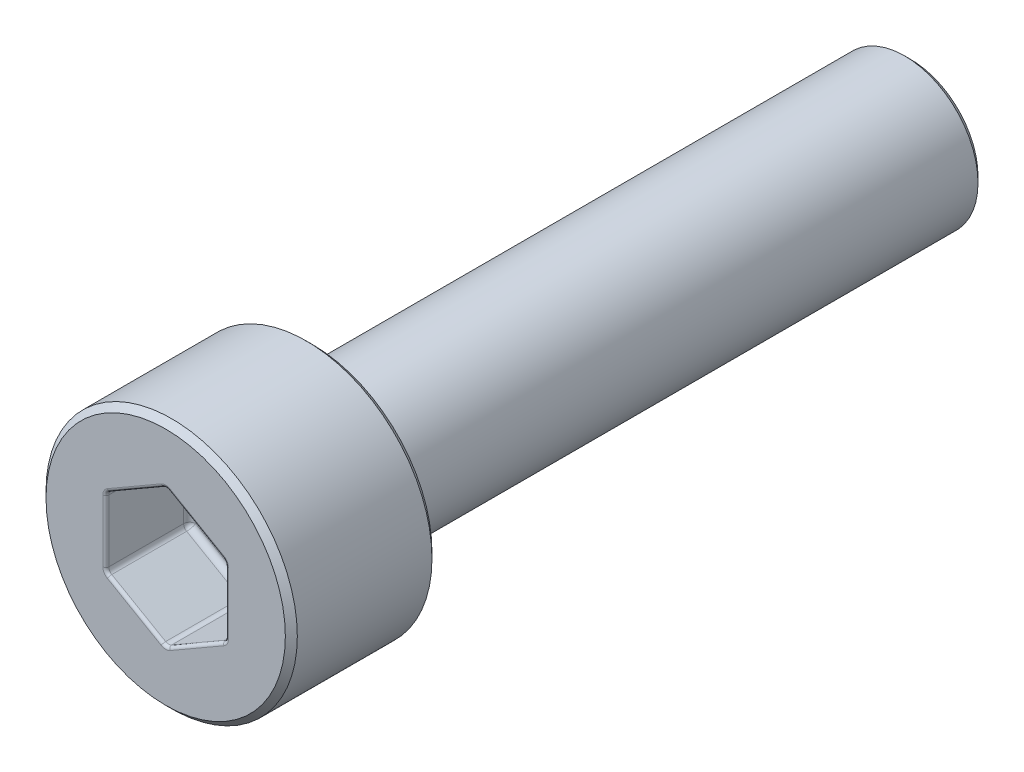
from build123d import *

# Parameters (mm, degrees)
SCHNITT_LINEAR_AUSTRAGEN1_DEPTH = 2.8
FASE1_SIZE                      = 0.2
VERRUNDUNG1_R                   = 0.2
VERRUNDUNG2_R                   = 0.1


with BuildPart() as part:
    # Skizze1 → Rotation1 (revolve)
    with BuildSketch(Plane(origin=(0, 0, 0), x_dir=(0, 0, -1), z_dir=(1, 0, 0))):
        Polygon((-4.9, 0), (-4.9, 4.2), (0, 4.2), (0, 2.45), (20, 2.45), (20, 0), align=None)
    revolve(axis=Axis((0, 0, 21.919879518), (0, 0, -1)))

    # Skizze2 → Schnitt-Linear austragen1 (cut)
    with BuildSketch(Plane.XY.offset(4.9)):
        Polygon((2, -1.154700538), (2, 1.154700538), (0, 2.309401077), (-2, 1.154700538), (-2, -1.154700538), (0, -2.309401077), align=None)
    extrude(amount=-SCHNITT_LINEAR_AUSTRAGEN1_DEPTH, mode=Mode.SUBTRACT)

    # Fase1
    fase1_edges = [part.edges().sort_by_distance(p)[0] for p in [
        (0, -4.2, 4.9),
        (0, -4.2, 0),
        (0, -2.45, -20),
    ]]
    chamfer(fase1_edges, length=FASE1_SIZE)

    # Verrundung1
    verrundung1_edges = [part.edges().sort_by_distance(p)[0] for p in [
        (-1, -1.732050808, 2.1),
        (-2, 0, 2.1),
        (-1, 1.732050808, 2.1),
        (1, 1.732050808, 2.1),
        (2, 0, 2.1),
        (1, -1.732050808, 2.1),
        (-2, -1.154700538, 3.5),
        (0, -2.309401077, 3.5),
        (2, -1.154700538, 3.5),
        (2, 1.154700538, 3.5),
        (0, 2.309401077, 3.5),
        (-2, 1.154700538, 3.5),
        (0, -2.45, 0),
    ]]
    fillet(verrundung1_edges, radius=VERRUNDUNG1_R)

    # Verrundung2
    verrundung2_edges = [part.edges().sort_by_distance(p)[0] for p in [
        (1.973205081, -1.139230485, 4.9),
        (1, -1.732050808, 4.9),
        (0, -2.278460969, 4.9),
        (-1, -1.732050808, 4.9),
        (-1.973205081, -1.139230485, 4.9),
        (-2, 0, 4.9),
        (-1.973205081, 1.139230485, 4.9),
        (-1, 1.732050808, 4.9),
        (0, 2.278460969, 4.9),
        (1, 1.732050808, 4.9),
        (1.973205081, 1.139230485, 4.9),
        (2, 0, 4.9),
    ]]
    fillet(verrundung2_edges, radius=VERRUNDUNG2_R)


solid = part.part
